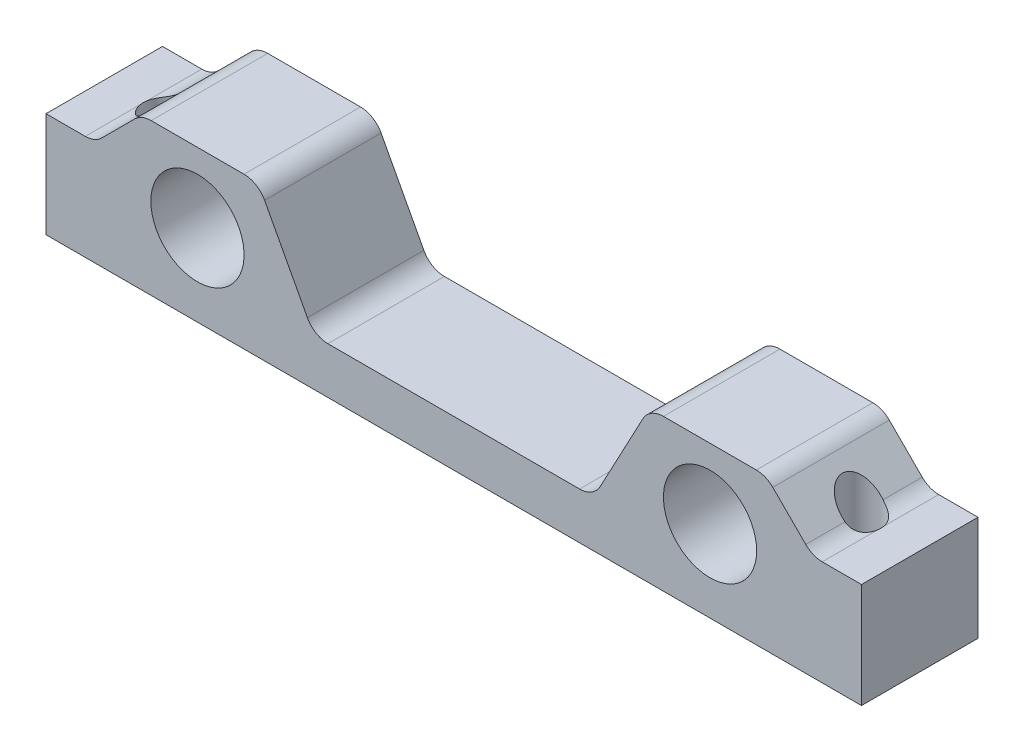
from build123d import *

# Parameters (mm, degrees)
SKETCH1_R                   = 4
BOSS_EXTRUDE1_DEPTH         = 5
FILLET1_R                   = 2
M4_TAPPED_HOLE1_D           = 3.3
M4_TAPPED_HOLE1_CSINK_D     = 4.05
M4_TAPPED_HOLE1_CSINK_ANGLE = 90


with BuildPart() as part:
    # Sketch1 → Boss-Extrude1 (new, symmetric)
    with BuildSketch(Plane.XY):
        Polygon((-35, 0), (35, 0), (35, 9), (30.8, 9), (26.8, 13), (16.8, 13), (12, 4), (-12, 4), (-16.8, 13), (-26.8, 13), (-30.8, 9), (-35, 9), align=None)
        with Locations((22, 7)):
            Circle(SKETCH1_R, mode=Mode.SUBTRACT)
        with Locations(Location((-22, 7, 0), (0, 0, 180))):
            Circle(SKETCH1_R, mode=Mode.SUBTRACT)
    extrude(amount=BOSS_EXTRUDE1_DEPTH, both=True)

    # Fillet1
    fillet1_edges = [part.edges().sort_by_distance(p)[0] for p in [
        (-30.8, 9, 0),
        (-26.8, 13, 0),
        (-16.8, 13, 0),
        (-12, 4, 0),
        (12, 4, 0),
        (16.8, 13, 0),
        (26.8, 13, 0),
        (30.8, 9, 0),
    ]]
    fillet(fillet1_edges, radius=FILLET1_R)

    # M4 Tapped Hole1 (through all)
    with Locations(Plane(origin=(0, 0, 0), x_dir=(-1, 0, 0), z_dir=(0, -1, 0))):
        with Locations((-30, 0), (30, 0)):
            CounterSinkHole(M4_TAPPED_HOLE1_D / 2, M4_TAPPED_HOLE1_CSINK_D / 2, counter_sink_angle=M4_TAPPED_HOLE1_CSINK_ANGLE)


solid = part.part
